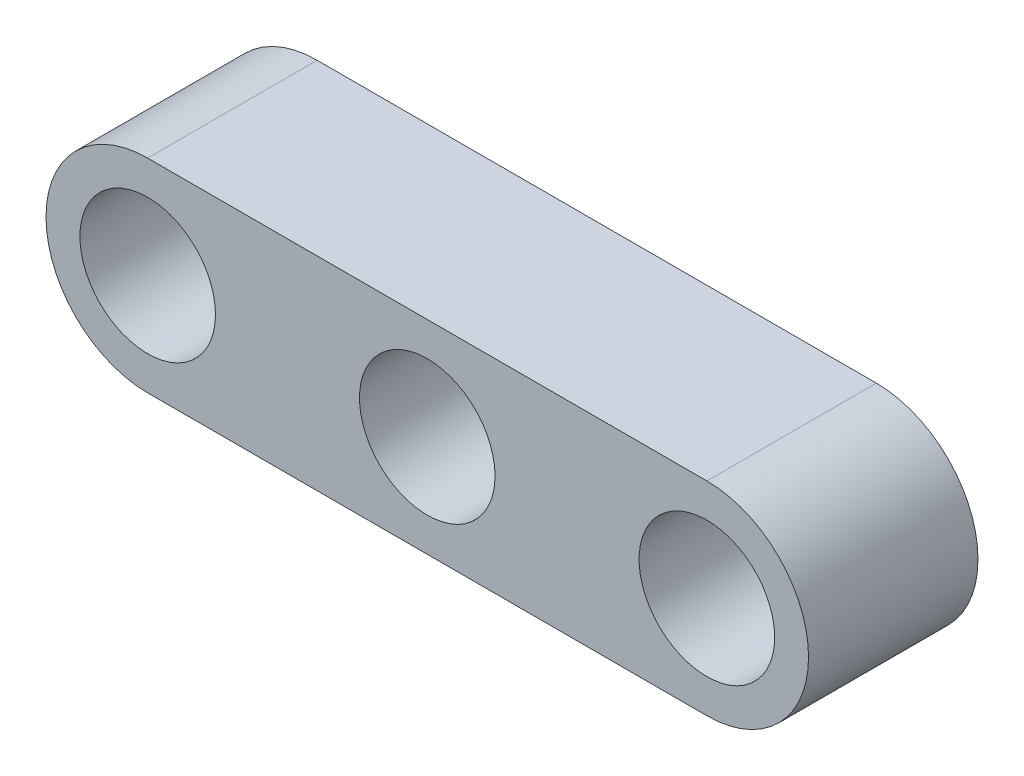
from build123d import *

# Parameters (mm, degrees)
SKETCH1_R           = 2
BOSS_EXTRUDE1_DEPTH = 5


with BuildPart() as part:
    # Sketch1 → Boss-Extrude1 (new body)
    with BuildSketch(Plane.XY):
        with BuildLine():
            Line((-11.81634754, 3), (4.68365246, 3))
            ThreePointArc((4.68365246, 3), (7.68365246, 0), (4.68365246, -3))
            Line((4.68365246, -3), (-11.81634754, -3))
            ThreePointArc((-11.81634754, -3), (-14.81634754, 0), (-11.81634754, 3))
        make_face()
        with Locations((-11.81634754, 0)):
            Circle(SKETCH1_R, mode=Mode.SUBTRACT)
        with Locations((4.68365246, 0)):
            Circle(SKETCH1_R, mode=Mode.SUBTRACT)
        with Locations((-3.56634754, 0)):
            Circle(SKETCH1_R, mode=Mode.SUBTRACT)
    extrude(amount=BOSS_EXTRUDE1_DEPTH)


solid = part.part
